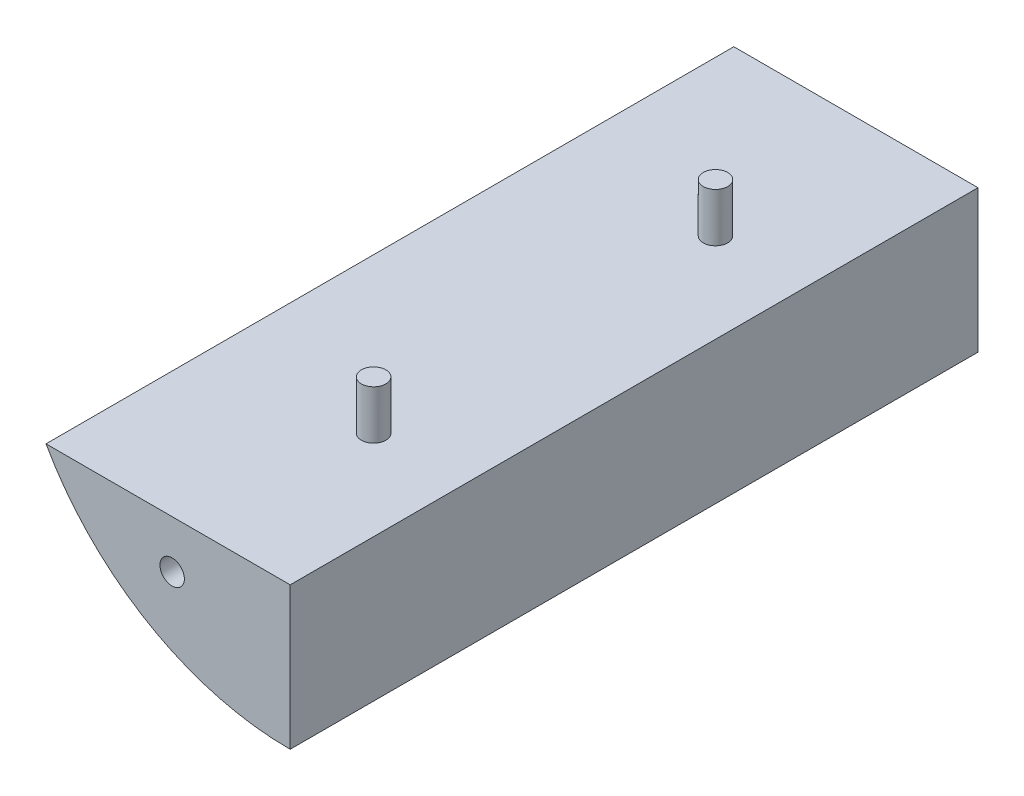
from build123d import *

# Parameters (mm, degrees)
BOSS_EXTRU_1_DEPTH      = 169
ESQUISSE2_R             = 3.307300662
ENL_V_MAT_EXTRU_1_DEPTH = 22
ESQUISSE3_R             = 3
BOSS_EXTRU_3_DEPTH      = 12
ESQUISSE4_R             = 3
BOSS_EXTRU_4_DEPTH      = 12
ESQUISSE5_R             = 3
ENL_V_MAT_EXTRU_2_DEPTH = 22


with BuildPart() as part:
    # Esquisse1 → Boss.-Extru.1 (new body)
    with BuildSketch(Plane.XY):
        with BuildLine():
            Line((0, 0), (60, 0))
            Line((60, 0), (60, -35))
            ThreePointArc((60, -35), (25.240598959, -25.658973212), (0, 0))
        make_face()
    extrude(amount=BOSS_EXTRU_1_DEPTH)

    # Esquisse2 → Enlèv. mat.-Extru.1 (cut)
    with BuildSketch(Plane(origin=(0, 0, 0), x_dir=(-1, 0, 0), z_dir=(0, 0, -1))):
        with Locations((-31, -12)):
            Circle(ESQUISSE2_R)
    extrude(amount=-ENL_V_MAT_EXTRU_1_DEPTH, mode=Mode.SUBTRACT)

    # Esquisse3 → Boss.-Extru.3 (add)
    with BuildSketch(Plane(origin=(0, 0, 0), x_dir=(1, 0, 0), z_dir=(0, 1, 0))):
        with Locations(Location((38, -42.5, 0), (0, 0, 90))):
            Circle(ESQUISSE3_R)
    extrude(amount=BOSS_EXTRU_3_DEPTH)

    # Esquisse4 → Boss.-Extru.4 (add)
    with BuildSketch(Plane(origin=(0, 0, 0), x_dir=(1, 0, 0), z_dir=(0, 1, 0))):
        with Locations(Location((38, -126.5, 0), (0, 0, 90))):
            Circle(ESQUISSE4_R)
    extrude(amount=BOSS_EXTRU_4_DEPTH)

    # Esquisse5 → Enlèv. mat.-Extru.2 (cut)
    with BuildSketch(Plane.XY.offset(169)):
        with Locations((31, -11.770310322)):
            Circle(ESQUISSE5_R)
    extrude(amount=-ENL_V_MAT_EXTRU_2_DEPTH, mode=Mode.SUBTRACT)


solid = part.part
